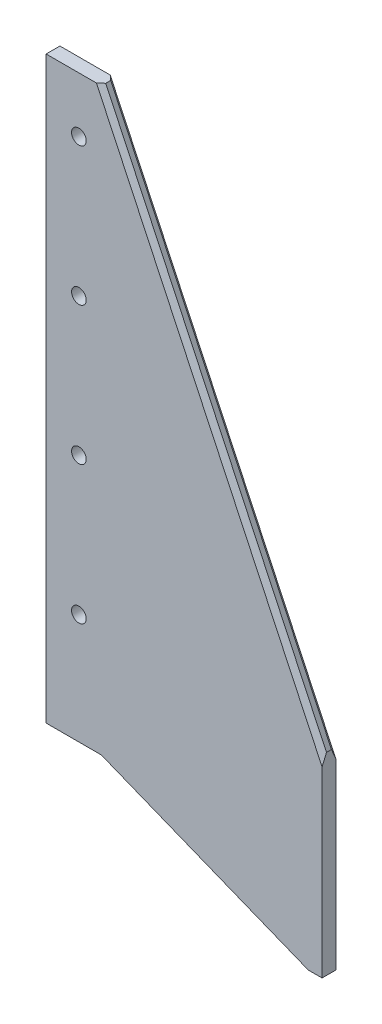
from build123d import *

# Parameters (mm, degrees)
BOSS_EXTRUDE1_DEPTH     = 6.35
CHAMFER1_SIZE           = 2.032
F_1_4_CLEARANCE_HOLE1_D = 6.7564
LPATTERN1_COUNT         = 4
LPATTERN1_PITCH         = 63.5


with BuildPart() as part:
    # Sketch1 → Boss-Extrude1 (new body)
    with BuildSketch(Plane.XY):
        Polygon((101.6, 12.7), (101.6, -76.2), (95.25, -76.2), (0, -38.1), (-25.4, -38.1), (-25.4, 0), (-25.4, 228.6), (0, 228.6), align=None)
    extrude(amount=BOSS_EXTRUDE1_DEPTH)

    # Chamfer1
    chamfer1_edges = [part.edges().sort_by_distance(p)[0] for p in [
        (50.8, 120.65, 0),
        (50.8, 120.65, 6.35),
    ]]
    chamfer(chamfer1_edges, length=CHAMFER1_SIZE)

    # 1/4 Clearance Hole1 (through all)
    with Locations(Plane.XY.offset(6.35)):
        with Locations((-10.31875, 203.2)):
            f_1_4_clearance_hole1 = Hole(F_1_4_CLEARANCE_HOLE1_D / 2)

    # LPattern1: 1/4 Clearance Hole1 ×4
    with Locations(*[(0, -i * LPATTERN1_PITCH, 0) for i in range(1, LPATTERN1_COUNT)]):
        add(f_1_4_clearance_hole1, mode=Mode.SUBTRACT)


solid = part.part
